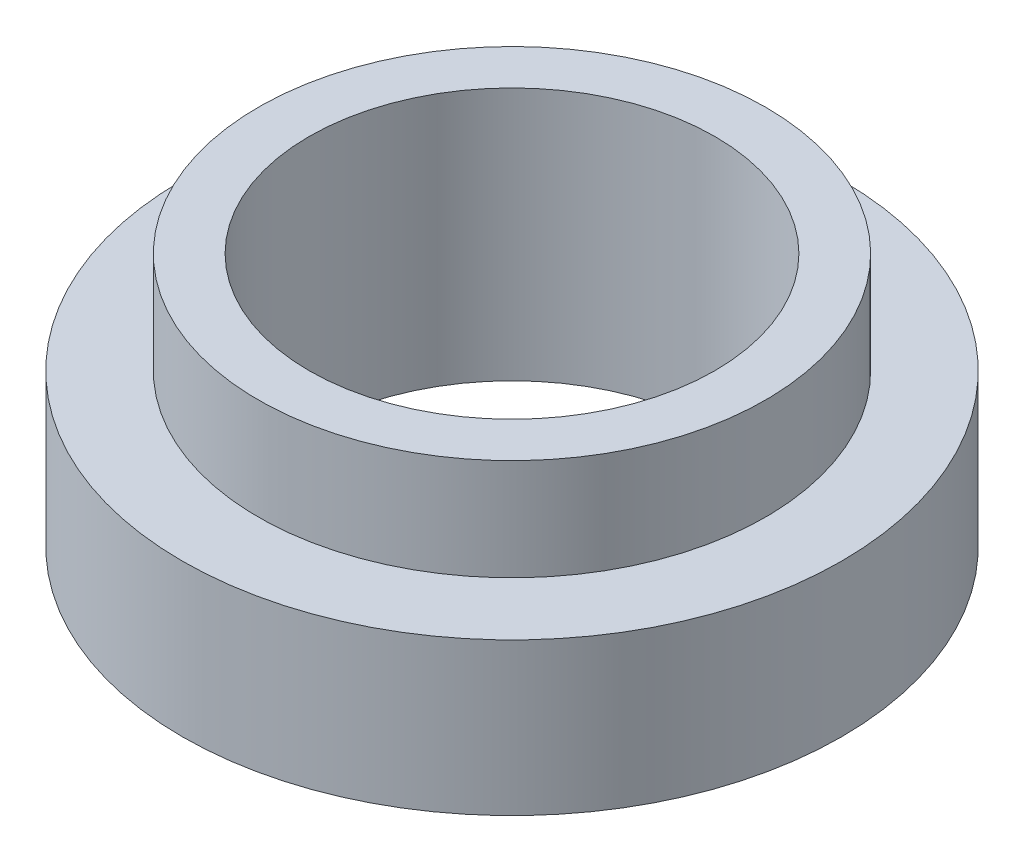
from build123d import *


with BuildPart() as part:
    # Schizzo1 → Rivoluzione1 (revolve)
    with BuildSketch(Plane.XY, mode=Mode.PRIVATE) as rivoluzione1_sk:
        Polygon((-6.5, 14.317789702), (-4, 14.317789702), (-4, 19.317789702), (-5, 19.317789702), (-5, 17.317789702), (-6.5, 17.317789702), align=None)
    revolve(rivoluzione1_sk.sketch.rotate(Axis((0, 0, 0), (0, 1, 0)), 270), axis=Axis((0, 0, 0), (0, 1, 0)))


solid = part.part
